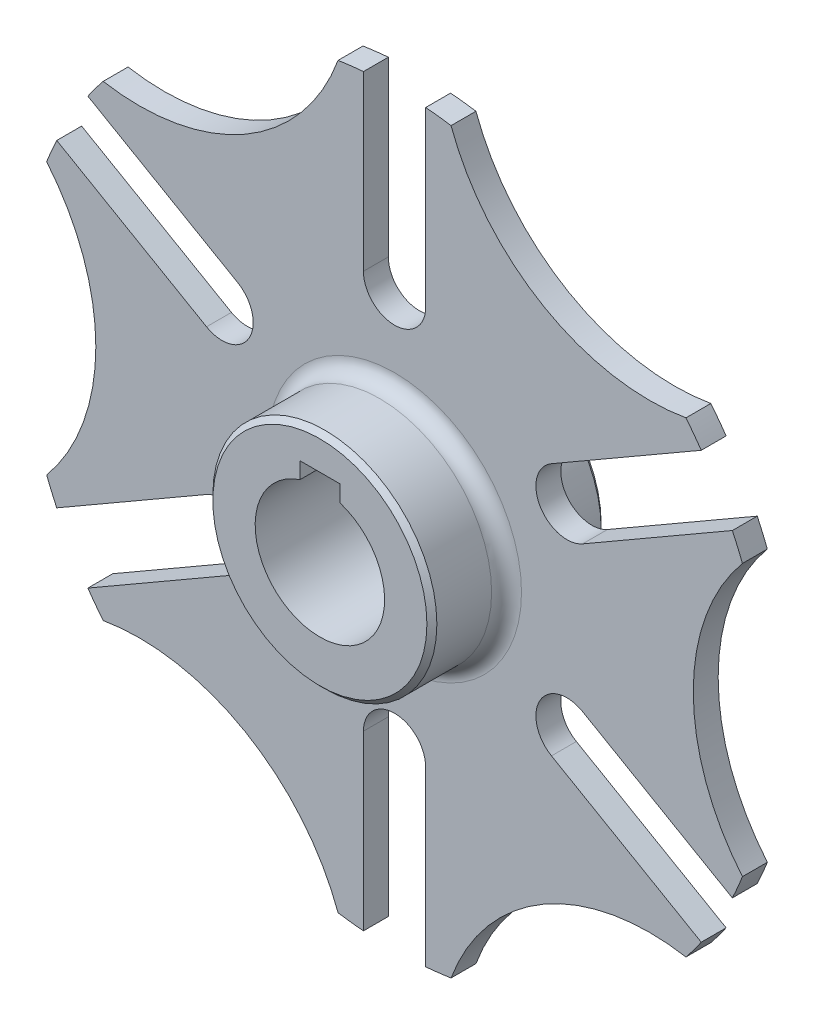
from build123d import *

# Parameters (mm, degrees)
SKETCH1_R           = 75
BOSS_EXTRUDE1_DEPTH = 2.5
SKETCH2_R           = 22.5
BOSS_EXTRUDE2_DEPTH = 17.5
SKETCH3_R           = 13
CUT_EXTRUDE1_DEPTH  = 35
CUT_EXTRUDE2_DEPTH  = 35
CUT_EXTRUDE3_DEPTH  = 35
CHAMFER1_SIZE       = 1
FILLET1_R           = 3
CHAMFER2_SIZE       = 1


with BuildPart() as part:
    # Sketch1 → Boss-Extrude1 (new, symmetric)
    with BuildSketch(Plane.XY):
        Circle(SKETCH1_R)
    extrude(amount=BOSS_EXTRUDE1_DEPTH, both=True)

    # Sketch2 → Boss-Extrude2 (add, symmetric)
    with BuildSketch(Plane.XY):
        Circle(SKETCH2_R)
    extrude(amount=BOSS_EXTRUDE2_DEPTH, both=True)

    # Sketch3 → Cut-Extrude1 (cut)
    with BuildSketch(Plane.XY.offset(17.5)):
        Circle(SKETCH3_R)
    extrude(amount=-CUT_EXTRUDE1_DEPTH, mode=Mode.SUBTRACT)

    # Sketch4 → Cut-Extrude2 (cut)
    with BuildSketch(Plane.XY.offset(2.5)):
        with BuildLine():
            ThreePointArc((58.530203334, 46.895791897), (37.5, 64.951905284), (11.347845446, 74.136538925))
            ThreePointArc((11.347845446, 74.136538925), (30, 51.961524227), (58.530203334, 46.895791897))
        make_face()
        with BuildLine():
            ThreePointArc((67.850984929, 31.956906049), (64.951905284, 37.5), (61.600984929, 42.782223596))
            Line((61.600984929, 42.782223596), (31.516016151, 25.412658774))
            ThreePointArc((31.516016151, 25.412658774), (29.228357378, 16.875), (37.766016151, 14.587341226))
            Line((37.766016151, 14.587341226), (67.850984929, 31.956906049))
        make_face()
        with BuildLine():
            ThreePointArc((75, 0), (73.708390494, 13.85904653), (69.87804878, 27.240747028))
            ThreePointArc((69.87804878, 27.240747028), (60, 0), (69.87804878, -27.240747028))
            ThreePointArc((69.87804878, -27.240747028), (73.708390494, -13.85904653), (75, 0))
        make_face()
        with BuildLine():
            ThreePointArc((61.600984929, -42.782223596), (64.951905284, -37.5), (67.850984929, -31.956906049))
            Line((67.850984929, -31.956906049), (37.766016151, -14.587341226))
            ThreePointArc((37.766016151, -14.587341226), (29.228357378, -16.875), (31.516016151, -25.412658774))
            Line((31.516016151, -25.412658774), (61.600984929, -42.782223596))
        make_face()
        with BuildLine():
            ThreePointArc((11.347845446, -74.136538925), (37.5, -64.951905284), (58.530203334, -46.895791897))
            ThreePointArc((58.530203334, -46.895791897), (30, -51.961524227), (11.347845446, -74.136538925))
        make_face()
        with BuildLine():
            Line((-6.25, -40), (-6.25, -74.739129644))
            ThreePointArc((-6.25, -74.739129644), (0, -75), (6.25, -74.739129644))
            Line((6.25, -74.739129644), (6.25, -40))
            ThreePointArc((6.25, -40), (0, -33.75), (-6.25, -40))
        make_face()
        with BuildLine():
            ThreePointArc((-11.347845446, -74.136538925), (-30, -51.961524227), (-58.530203334, -46.895791897))
            ThreePointArc((-58.530203334, -46.895791897), (-37.5, -64.951905284), (-11.347845446, -74.136538925))
        make_face()
        with BuildLine():
            Line((-37.766016151, -14.587341226), (-67.850984929, -31.956906049))
            ThreePointArc((-67.850984929, -31.956906049), (-64.951905284, -37.5), (-61.600984929, -42.782223596))
            Line((-61.600984929, -42.782223596), (-31.516016151, -25.412658774))
            ThreePointArc((-31.516016151, -25.412658774), (-29.228357378, -16.875), (-37.766016151, -14.587341226))
        make_face()
        with BuildLine():
            ThreePointArc((-69.87804878, -27.240747028), (-60, 0), (-69.87804878, 27.240747028))
            ThreePointArc((-69.87804878, 27.240747028), (-75, 0), (-69.87804878, -27.240747028))
        make_face()
        with BuildLine():
            Line((-31.516016151, 25.412658774), (-61.600984929, 42.782223596))
            ThreePointArc((-61.600984929, 42.782223596), (-64.951905284, 37.5), (-67.850984929, 31.956906049))
            Line((-67.850984929, 31.956906049), (-37.766016151, 14.587341226))
            ThreePointArc((-37.766016151, 14.587341226), (-29.228357378, 16.875), (-31.516016151, 25.412658774))
        make_face()
        with BuildLine():
            ThreePointArc((-58.530203334, 46.895791897), (-30, 51.961524227), (-11.347845446, 74.136538925))
            ThreePointArc((-11.347845446, 74.136538925), (-37.5, 64.951905284), (-58.530203334, 46.895791897))
        make_face()
        with BuildLine():
            Line((-6.25, 74.739129644), (-6.25, 40))
            ThreePointArc((-6.25, 40), (0, 33.75), (6.25, 40))
            Line((6.25, 40), (6.25, 74.739129644))
            ThreePointArc((6.25, 74.739129644), (0, 75), (-6.25, 74.739129644))
        make_face()
    extrude(amount=-CUT_EXTRUDE2_DEPTH, mode=Mode.SUBTRACT)

    # Sketch5 → Cut-Extrude3 (cut)
    with BuildSketch(Plane.XY.offset(17.5)):
        with BuildLine():
            Line((-4, 12.369316877), (-4, 15.669316877))
            Line((-4, 15.669316877), (4, 15.669316877))
            Line((4, 15.669316877), (4, 12.369316877))
            ThreePointArc((4, 12.369316877), (0, 13), (-4, 12.369316877))
        make_face()
    extrude(amount=-CUT_EXTRUDE3_DEPTH, mode=Mode.SUBTRACT)

    # Chamfer1
    chamfer1_edges = [part.edges().sort_by_distance(p)[0] for p in [
        (-22.5, 0, 17.5),
    ]]
    chamfer(chamfer1_edges, length=CHAMFER1_SIZE)

    # Fillet1
    fillet1_edges = [part.edges().sort_by_distance(p)[0] for p in [
        (-22.5, 0, -2.5),
        (-22.5, 0, 2.5),
    ]]
    fillet(fillet1_edges, radius=FILLET1_R)

    # Chamfer2
    chamfer2_edges = [part.edges().sort_by_distance(p)[0] for p in [
        (-22.5, 0, -17.5),
    ]]
    chamfer(chamfer2_edges, length=CHAMFER2_SIZE)


solid = part.part
